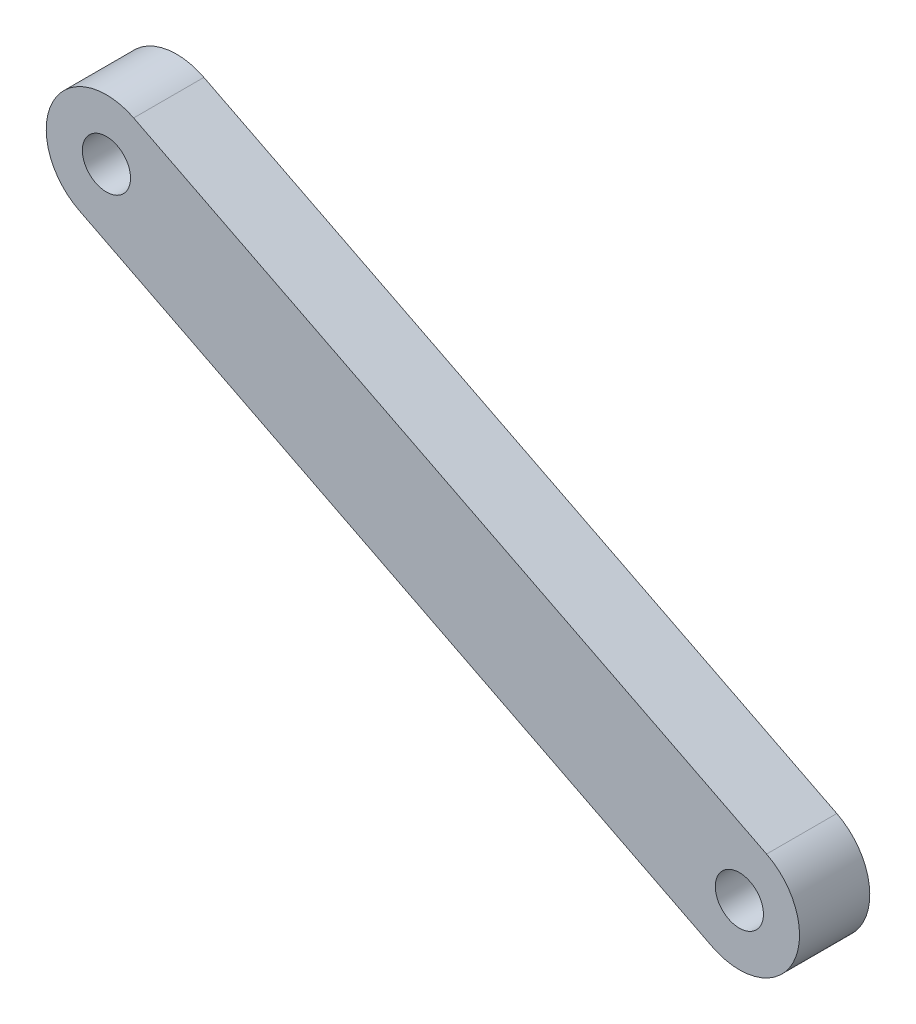
from build123d import *

# Parameters (mm, degrees)
SKETCH16_R           = 120
BOSS_EXTRUDE13_DEPTH = 350


with BuildPart() as part:
    # Sketch16 → Boss-Extrude13 (new body)
    with BuildSketch(Plane.XY):
        with BuildLine():
            Line((-135.708408551, -267.550421133), (3018.665544647, -1867.529473116))
            ThreePointArc((3018.665544647, -1867.529473116), (3421.924374331, -1735.687460534), (3290.082361748, -1332.42863085))
            Line((3290.082361748, -1332.42863085), (135.708408551, 267.550421133))
            ThreePointArc((135.708408551, 267.550421133), (-267.550421133, 135.708408551), (-135.708408551, -267.550421133))
        make_face()
        Circle(SKETCH16_R, mode=Mode.SUBTRACT)
        with Locations((3154.373953197, -1599.979051983)):
            Circle(SKETCH16_R, mode=Mode.SUBTRACT)
    extrude(amount=BOSS_EXTRUDE13_DEPTH)


solid = part.part
